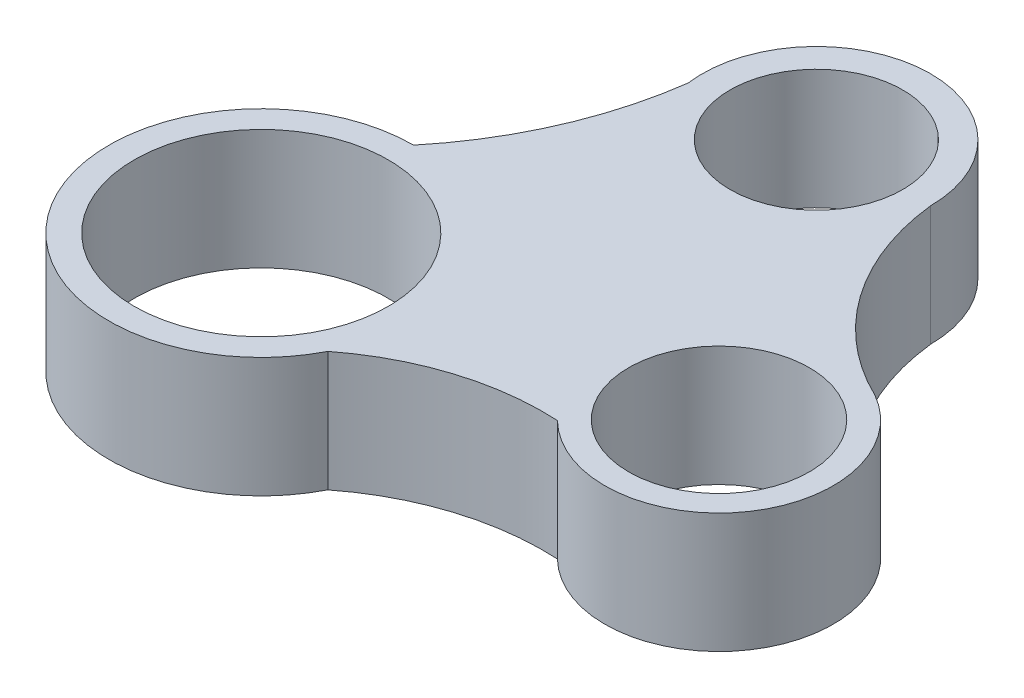
from build123d import *

# Parameters (mm, degrees)
SKETCH1_R           = 12.7
SKETCH1_R_2         = 10.587882435
SKETCH1_R_3         = 9.525
SKETCH1_R_4         = 7.199480632
SKETCH1_R_5         = 7.531788478
BOSS_EXTRUDE1_DEPTH = 10


with BuildPart() as part:
    # Sketch1 → Boss-Extrude1 (new body)
    # profile 1 of 4: a face of its own
    with BuildSketch(Plane(origin=(0, 0, 0), x_dir=(1, 0, 0), z_dir=(0, 1, 0))):
        with BuildLine():
            ThreePointArc((0, 12.7), (8.980256121, 8.980256121), (12.7, 0))
            ThreePointArc((12.7, 0), (12.349099919, -2.964748082), (11.315790364, -5.765664614))
            ThreePointArc((11.315790364, -5.765664614), (18.18064615, -2.153516868), (25.877180845, -1.185420811))
            ThreePointArc((25.877180845, -1.185420811), (24.696409251, 10.976736126), (36.457129285, 14.293021273))
            ThreePointArc((36.457129285, 14.293021273), (29.270833309, 20.788359993), (25.925837497, 29.879194827))
            ThreePointArc((25.925837497, 29.879194827), (17.031652126, 20.375106343), (6.959391743, 28.620335393))
            ThreePointArc((6.959391743, 28.620335393), (4.592983555, 20.173506773), (0, 12.7))
        make_face()
    # profile 2 of 4: a face of its own
    with BuildSketch(Plane(origin=(0, 0, 0), x_dir=(1, 0, 0), z_dir=(0, 1, 0))):
        Circle(SKETCH1_R)
        with Locations(Location((0, 0, 0), (0, 0, 270))):
            Circle(SKETCH1_R_2, mode=Mode.SUBTRACT)
    # profile 3 of 4: a face of its own
    with BuildSketch(Plane(origin=(0, 0, 0), x_dir=(1, 0, 0), z_dir=(0, 1, 0))):
        with Locations((16.400837497, 29.879194827)):
            Circle(SKETCH1_R_3)
        with Locations(Location((16.400837497, 29.879194827, 0), (0, 0, 270))):
            Circle(SKETCH1_R_4, mode=Mode.SUBTRACT)
    # profile 4 of 4: a face of its own
    with BuildSketch(Plane(origin=(0, 0, 0), x_dir=(1, 0, 0), z_dir=(0, 1, 0))):
        with BuildLine():
            ThreePointArc((36.457129285, 14.293021273), (24.696409251, 10.976736126), (25.877180845, -1.185420811))
            ThreePointArc((25.877180845, -1.185420811), (36.239101244, -3.183980484), (42.084961355, 5.601778145))
            ThreePointArc((42.084961355, 5.601778145), (40.798229992, 10.382631088), (37.285684743, 13.871794073))
            ThreePointArc((37.285684743, 13.871794073), (36.8689887, 14.077650841), (36.457129285, 14.293021273))
        make_face()
        with Locations(Location((32.559961355, 5.601778145, 0), (0, 0, 270))):
            Circle(SKETCH1_R_5, mode=Mode.SUBTRACT)
    extrude(amount=BOSS_EXTRUDE1_DEPTH)


solid = part.part
